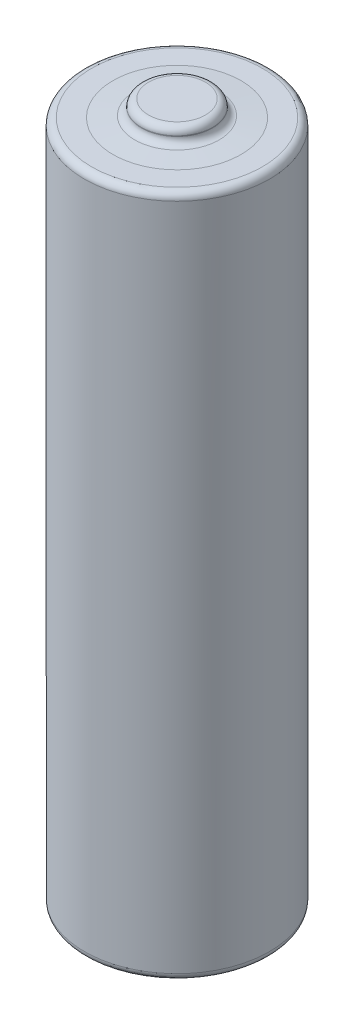
from build123d import *

# Parameters (mm, degrees)
REDONDEO1_R = 0.5


with BuildPart() as part:
    # Croquis2 → Revolución1 (revolve)
    with BuildSketch(Plane(origin=(0, 0, 0), x_dir=(0, 0, -1), z_dir=(1, 0, 0))):
        Polygon((2.083734943, 15.916127666), (4.583734943, 15.916127666), (4.583734943, 14.916127666), (6.583734943, 14.763533095), (8.583734943, 14.763533095), (8.583734943, -33.236466905), (6.083734943, -33.236466905), (6.083734943, -34.236466905), (2.083734943, -34.236466905), align=None)
    revolve(axis=Axis((0, -34.236466905, -2.083734943), (0, 1, 0)))

    # Redondeo1
    redondeo1_edges = [part.edges().sort_by_distance(p)[0] for p in [
        (0, -34.236466905, 1.916265057),
        (0, -33.236466905, 4.416265057),
        (0, 14.763533095, 4.416265057),
        (0, 14.916127666, 0.416265057),
        (0, 15.916127666, 0.416265057),
    ]]
    fillet(redondeo1_edges, radius=REDONDEO1_R)


solid = part.part
